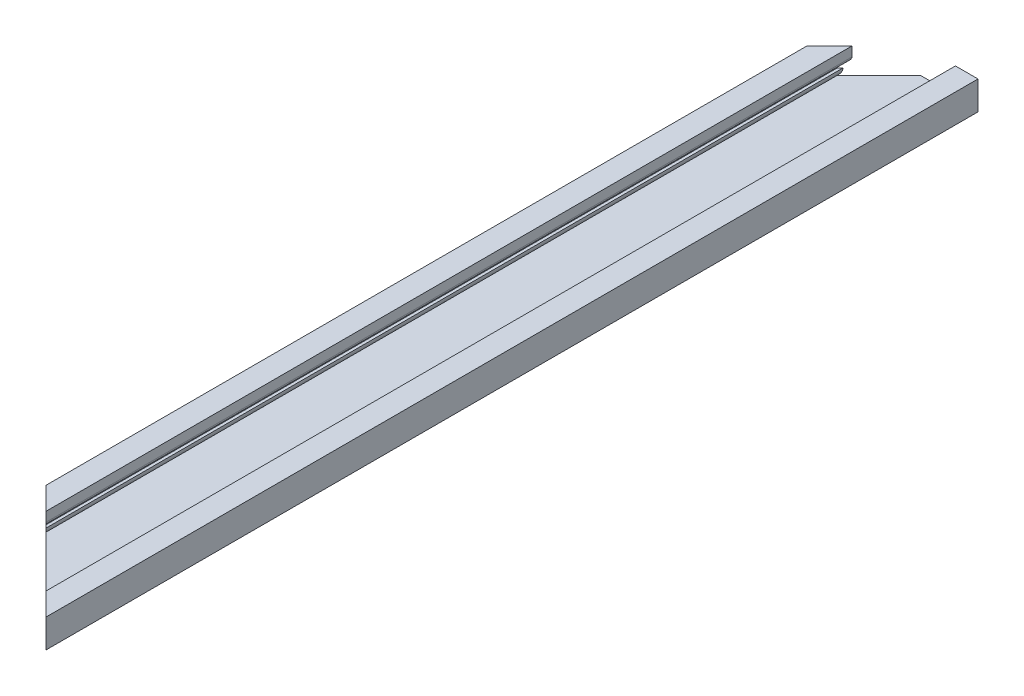
from build123d import *

# Parameters (mm, degrees)
SKETCH_1_W               = 60
SKETCH_1_H               = 15
EXTRUDE_1_DEPTH          = 520
SKETCH_2_R               = 3
CUT_EXTRUDE_1_DEPTH      = 521.918659677
CUT_EXTRUDE_2_DEPTH      = 521.918659677
SKETCH_4_W               = 36.3
SKETCH_4_H               = 7
CUT_EXTRUDE_3_DEPTH      = 521.918659677
FILLET_1_R               = 2
CUT_EXTRUDE_4_DEPTH      = 522.080607968
CUT_EXTRUDE_6_DEPTH      = 522.080607968
CUT_EXTRUDE_6_DEPTH_BACK = 522.080607968
SKETCH_7_W               = 30
SKETCH_7_H               = 30


with BuildPart() as part:
    # 스케치1 → 보스-돌출1 (new body)
    with BuildSketch(Plane.XY):
        Rectangle(SKETCH_1_W, SKETCH_1_H)
    extrude(amount=EXTRUDE_1_DEPTH)

    # 스케치2 → 컷-돌출1 (cut, through all)
    with BuildSketch(Plane(origin=(0, 0, 0), x_dir=(-1, 0, 0), z_dir=(0, 0, -1))):
        with Locations((-25, -2.5)):
            Circle(SKETCH_2_R)
        with Locations((25, -2.5)):
            Circle(SKETCH_2_R)
    extrude(amount=-CUT_EXTRUDE_1_DEPTH, mode=Mode.SUBTRACT)

    # 스케치3 → 컷-돌출2 (cut, through all)
    with BuildSketch(Plane(origin=(0, 0, 0), x_dir=(-1, 0, 0), z_dir=(0, 0, -1))):
        with BuildLine():
            Line((-22.171572875, -6), (22.171572875, -6))
            ThreePointArc((22.171572875, -6), (20.939339828, -4.439339828), (20.5, -2.5))
            Line((20.5, -2.5), (25, -2.5))
            Line((25, -2.5), (25, 0.5))
            Line((25, 0.5), (-25, 0.5))
            Line((-25, 0.5), (-25, -2.5))
            Line((-25, -2.5), (-20.5, -2.5))
            ThreePointArc((-20.5, -2.5), (-20.939339828, -4.439339828), (-22.171572875, -6))
        make_face()
    extrude(amount=-CUT_EXTRUDE_2_DEPTH, mode=Mode.SUBTRACT)

    # 스케치4 → 컷-돌출3 (cut, through all)
    with BuildSketch(Plane(origin=(0, 0, 0), x_dir=(-1, 0, 0), z_dir=(0, 0, -1))):
        with Locations((0.006888359, 4)):
            Rectangle(SKETCH_4_W, SKETCH_4_H)
    extrude(amount=-CUT_EXTRUDE_3_DEPTH, mode=Mode.SUBTRACT)

    # 필렛1
    fillet_1_edges = [part.edges().sort_by_distance(p)[0] for p in [
        (-18.156888359, 0.5, 260),
        (18.143111641, 0.5, 260),
    ]]
    fillet(fillet_1_edges, radius=FILLET_1_R)

    # 스케치5 → 컷-돌출4 (cut, through all)
    with BuildSketch(Plane.XZ.offset(7.5)):
        Polygon((-30, 520), (-30, 460), (30, 520), align=None)
        Polygon((-30, 0), (30, 0), (-30, 60), align=None)
    extrude(amount=-CUT_EXTRUDE_4_DEPTH, mode=Mode.SUBTRACT)

    # 스케치7 → 컷-돌출6 (cut, two sides: drawn at the far end of the back side and taken through both)
    with BuildSketch(Plane.XZ.offset(7.5).offset(-CUT_EXTRUDE_6_DEPTH_BACK)):
        with Locations((15, 15)):
            Rectangle(SKETCH_7_W, SKETCH_7_H)
    extrude(amount=CUT_EXTRUDE_6_DEPTH + CUT_EXTRUDE_6_DEPTH_BACK, mode=Mode.SUBTRACT)


solid = part.part
